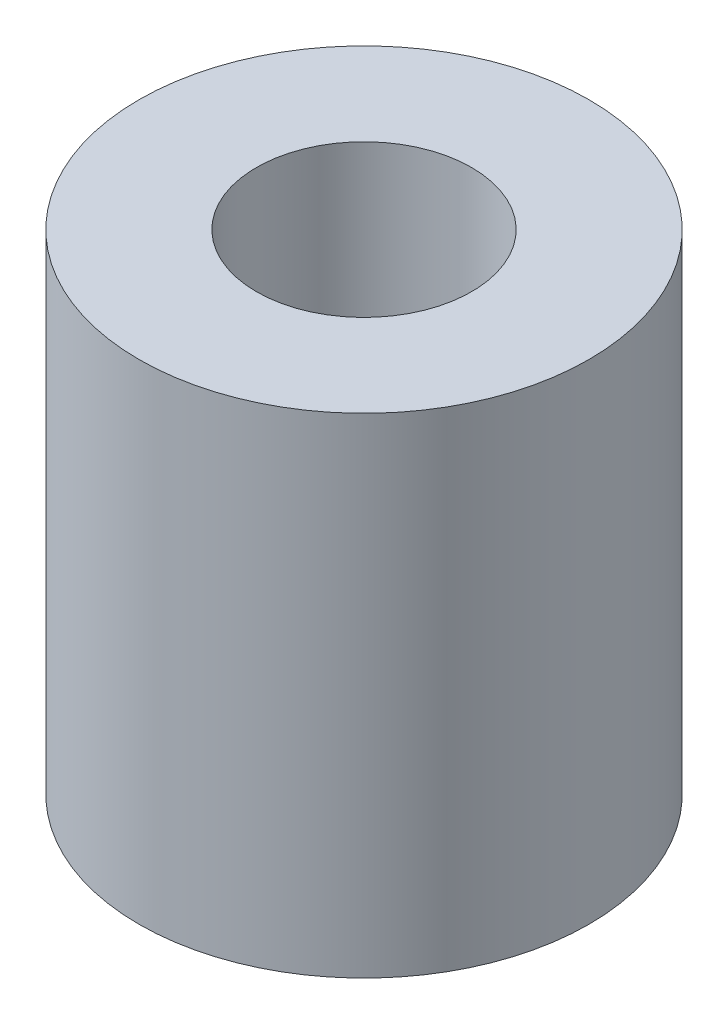
from build123d import *

# Parameters (mm, degrees)
CROQUIS1_R              = 11.5
CROQUIS1_R_2            = 5.5
SALIENTE_EXTRUIR1_DEPTH = 25


with BuildPart() as part:
    # Croquis1 → Saliente-Extruir1 (new body)
    with BuildSketch(Plane(origin=(0, 0, 0), x_dir=(1, 0, 0), z_dir=(0, 1, 0))):
        with Locations(Location((0, 0, 0), (0, 0, 270))):
            Circle(CROQUIS1_R)
        with Locations(Location((0, 0, 0), (0, 0, 270))):
            Circle(CROQUIS1_R_2, mode=Mode.SUBTRACT)
    extrude(amount=SALIENTE_EXTRUIR1_DEPTH)


solid = part.part
